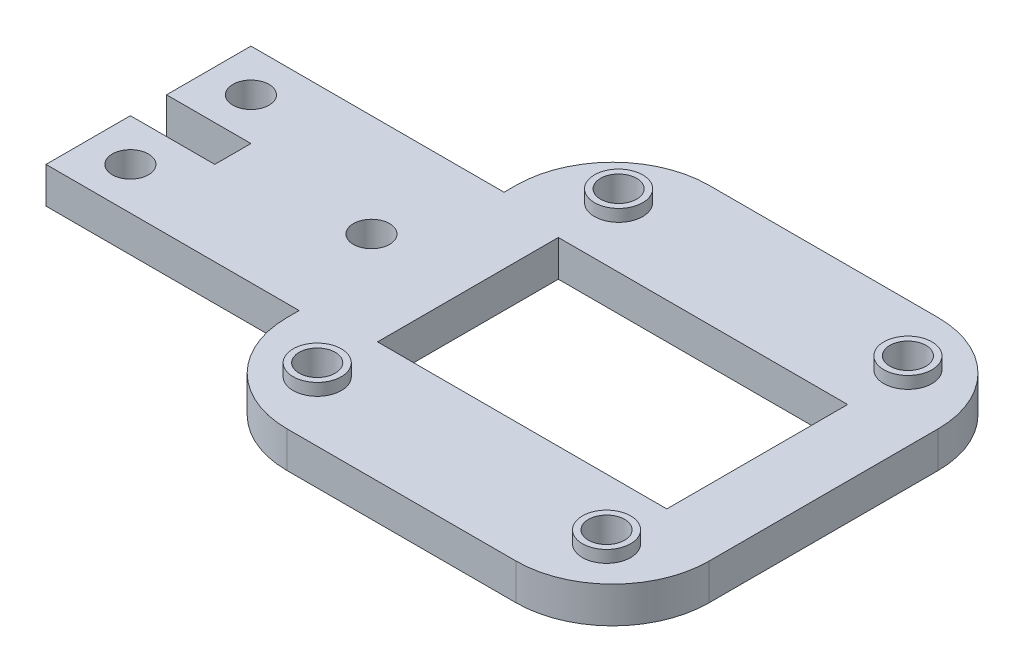
from build123d import *

# Parameters (mm, degrees)
SKETCH_1_R          = 1.5
SKETCH_1_W          = 24
SKETCH_1_H          = 15
EXTRUDE_1_DEPTH     = 3
SKETCH_2_R          = 2
SKETCH_2_R_2        = 1.5
EXTRUDE_2_DEPTH     = 1
CUT_EXTRUDE_1_REACH = 41.246
SKETCH_3_W          = 7
SKETCH_3_H          = 3
FILLET_1_R          = 8


with BuildPart() as part:
    # 草图1 → 凸台-拉伸1 (new body)
    with BuildSketch(Plane(origin=(0, 0, 0), x_dir=(1, 0, 0), z_dir=(0, 1, 0))):
        Polygon((-14, -8.5), (0, -8.5), (0, -17.5), (35, -17.5), (35, 17.5), (0, 17.5), (0, 8.5), (-14, 8.5), (-21, 8.5), (-21, -8.5), align=None)
        with Locations(Location((-2.5, 0, 0), (0, 0, 270))):
            Circle(SKETCH_1_R, mode=Mode.SUBTRACT)
        with Locations(Location((29.5, -12.5, 0), (0, 0, 270))):
            Circle(SKETCH_1_R, mode=Mode.SUBTRACT)
        with Locations(Location((5.5, -12.5, 0), (0, 0, 270))):
            Circle(SKETCH_1_R, mode=Mode.SUBTRACT)
        with Locations(Location((29.5, 12.5, 0), (0, 0, 270))):
            Circle(SKETCH_1_R, mode=Mode.SUBTRACT)
        with Locations(Location((5.5, 12.5, 0), (0, 0, 270))):
            Circle(SKETCH_1_R, mode=Mode.SUBTRACT)
        with Locations(Location((-17.5, -5, 0), (0, 0, 270))):
            Circle(SKETCH_1_R, mode=Mode.SUBTRACT)
        with Locations(Location((-17.5, 5, 0), (0, 0, 270))):
            Circle(SKETCH_1_R, mode=Mode.SUBTRACT)
        with Locations((17.5, 0)):
            Rectangle(SKETCH_1_W, SKETCH_1_H, mode=Mode.SUBTRACT)
    extrude(amount=EXTRUDE_1_DEPTH)

    # 草图2 → 凸台-拉伸2 (add)
    # profile 1 of 4: a face of its own
    with BuildSketch(Plane(origin=(0, 3, 0), x_dir=(1, 0, 0), z_dir=(0, 1, 0))):
        with Locations(Location((5.5, 12.5, 0), (0, 0, 270))):
            Circle(SKETCH_2_R)
        with Locations(Location((5.5, 12.5, 0), (0, 0, 270))):
            Circle(SKETCH_2_R_2, mode=Mode.SUBTRACT)
    # profile 2 of 4: a face of its own
    with BuildSketch(Plane(origin=(0, 3, 0), x_dir=(1, 0, 0), z_dir=(0, 1, 0))):
        with Locations(Location((29.5, 12.5, 0), (0, 0, 270))):
            Circle(SKETCH_2_R)
        with Locations(Location((29.5, 12.5, 0), (0, 0, 270))):
            Circle(SKETCH_2_R_2, mode=Mode.SUBTRACT)
    # profile 3 of 4: a face of its own
    with BuildSketch(Plane(origin=(0, 3, 0), x_dir=(1, 0, 0), z_dir=(0, 1, 0))):
        with Locations(Location((29.5, -12.5, 0), (0, 0, 270))):
            Circle(SKETCH_2_R)
        with Locations(Location((29.5, -12.5, 0), (0, 0, 270))):
            Circle(SKETCH_2_R_2, mode=Mode.SUBTRACT)
    # profile 4 of 4: a face of its own
    with BuildSketch(Plane(origin=(0, 3, 0), x_dir=(1, 0, 0), z_dir=(0, 1, 0))):
        with Locations(Location((5.5, -12.5, 0), (0, 0, 270))):
            Circle(SKETCH_2_R)
        with Locations(Location((5.5, -12.5, 0), (0, 0, 270))):
            Circle(SKETCH_2_R_2, mode=Mode.SUBTRACT)
    extrude(amount=EXTRUDE_2_DEPTH)

    # 草图3 → 切除-拉伸1 (cut, up to next)
    with BuildSketch(Plane(origin=(0, 3, 0), x_dir=(1, 0, 0), z_dir=(0, 1, 0)), mode=Mode.PRIVATE) as cut_extrude_1_sk1:
        with Locations((-17.5, 0)):
            Rectangle(SKETCH_3_W, SKETCH_3_H)
    cut_extrude_1_tool1 = extrude(cut_extrude_1_sk1.sketch, amount=-CUT_EXTRUDE_1_REACH, mode=Mode.PRIVATE) & part.part
    add(cut_extrude_1_tool1.solids().sort_by_distance((-17.5, 3, 0))[0], mode=Mode.SUBTRACT)

    # 圆角1
    fillet_1_edges = [part.edges().sort_by_distance(p)[0] for p in [
        (0, 1.5, -17.5),
        (35, 1.5, -17.5),
        (35, 1.5, 17.5),
        (0, 1.5, 17.5),
    ]]
    fillet(fillet_1_edges, radius=FILLET_1_R)


solid = part.part
